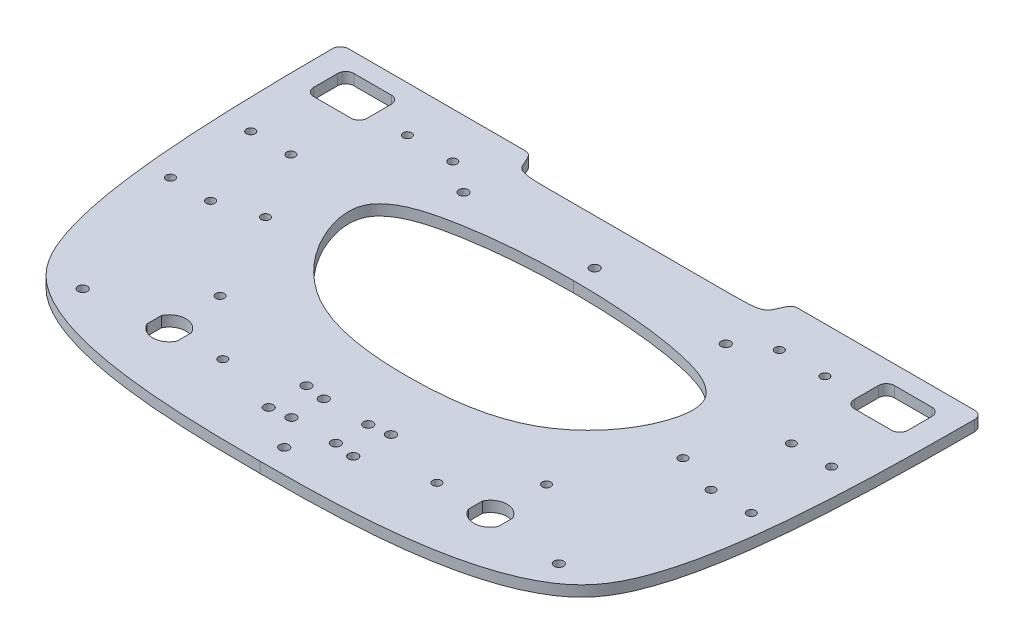
from build123d import *

# Parameters (mm, degrees)
SKETCH1_W           = 240
SKETCH1_H           = 310
BOSS_EXTRUDE1_DEPTH = 4
CUT_EXTRUDE1_REACH  = 198.064
SKETCH2_R           = 1.75
SKETCH3_R           = 1.75
CUT_EXTRUDE2_DEPTH  = 197.06376528
SKETCH4_R           = 1.75
CUT_EXTRUDE3_DEPTH  = 197.06184897
SKETCH5_R           = 1.6
CUT_EXTRUDE4_DEPTH  = 197.06184897
CUT_EXTRUDE5_DEPTH  = 197.06184897
SKETCH8_R           = 1.75
CUT_EXTRUDE7_DEPTH  = 197.06184897
FILLET1_R           = 3
CUT_EXTRUDE9_DEPTH  = 197.058343884
SKETCH14_R          = 1.6
CUT_EXTRUDE10_DEPTH = 197.058343884
SKETCH15_R          = 1.6
CUT_EXTRUDE11_DEPTH = 197.058343884
CUT_EXTRUDE12_DEPTH = 197.058343884


with BuildPart() as part:
    # Sketch1 → Boss-Extrude1 (new body)
    with BuildSketch(Plane(origin=(0, 0, 0), x_dir=(1, 0, 0), z_dir=(0, 1, 0))):
        Rectangle(SKETCH1_W, SKETCH1_H)
    extrude(amount=BOSS_EXTRUDE1_DEPTH)

    # Sketch2 → Cut-Extrude1 (cut, up to next)
    with BuildSketch(Plane(origin=(0, 4, 0), x_dir=(1, 0, 0), z_dir=(0, 1, 0)), mode=Mode.PRIVATE) as cut_extrude1_sk1:
        with BuildLine():
            Line((-120, 155), (-120, 0))
            add(Edge.make_bspline(
                [(0, 155), (-30.572222193, 155), (-80.343316982, 153.733320995), (-119.221157946, 117.654395612), (-120, 45.41001223), (-120, 0)],
                knots=[0, 0, 0, 0, 0.458017491, 0.558017491, 1, 1, 1, 1], degree=3))
            Line((0, 155), (-120, 155))
        make_face()
    cut_extrude1_tool1 = extrude(cut_extrude1_sk1.sketch, amount=-CUT_EXTRUDE1_REACH, mode=Mode.PRIVATE) & part.part
    # Sketch2 → Cut-Extrude1 (cut, up to next)
    with BuildSketch(Plane(origin=(0, 4, 0), x_dir=(1, 0, 0), z_dir=(0, 1, 0)), mode=Mode.PRIVATE) as cut_extrude1_sk2:
        with BuildLine():
            add(Edge.make_bspline(
                [(0, 155), (30.572222193, 155), (80.343316982, 153.733320995), (119.221157946, 117.654395612), (120, 45.41001223), (120, 0)],
                knots=[0, 0, 0, 0, 0.458017491, 0.558017491, 1, 1, 1, 1], degree=3))
            Line((120, 0), (120, 155))
            Line((120, 155), (0, 155))
        make_face()
    cut_extrude1_tool2 = extrude(cut_extrude1_sk2.sketch, amount=-CUT_EXTRUDE1_REACH, mode=Mode.PRIVATE) & part.part
    # Sketch2 → Cut-Extrude1 (cut, up to next)
    with BuildSketch(Plane(origin=(0, 4, 0), x_dir=(1, 0, 0), z_dir=(0, 1, 0)), mode=Mode.PRIVATE) as cut_extrude1_sk3:
        with BuildLine():
            Line((120, -155), (120, 0))
            add(Edge.make_bspline(
                [(0, -155), (30.572222193, -155), (80.343316982, -153.733320995), (119.221157946, -117.654395612), (120, -45.41001223), (120, 0)],
                knots=[0, 0, 0, 0, 0.458017491, 0.558017491, 1, 1, 1, 1], degree=3))
            Line((0, -155), (120, -155))
        make_face()
    cut_extrude1_tool3 = extrude(cut_extrude1_sk3.sketch, amount=-CUT_EXTRUDE1_REACH, mode=Mode.PRIVATE) & part.part
    # Sketch2 → Cut-Extrude1 (cut, up to next)
    with BuildSketch(Plane(origin=(0, 4, 0), x_dir=(1, 0, 0), z_dir=(0, 1, 0)), mode=Mode.PRIVATE) as cut_extrude1_sk4:
        with BuildLine():
            add(Edge.make_bspline(
                [(0, -155), (-30.572222193, -155), (-80.343316982, -153.733320995), (-119.221157946, -117.654395612), (-120, -45.41001223), (-120, 0)],
                knots=[0, 0, 0, 0, 0.458017491, 0.558017491, 1, 1, 1, 1], degree=3))
            Line((-120, 0), (-120, -155))
            Line((-120, -155), (0, -155))
        make_face()
    cut_extrude1_tool4 = extrude(cut_extrude1_sk4.sketch, amount=-CUT_EXTRUDE1_REACH, mode=Mode.PRIVATE) & part.part
    # Sketch2 → Cut-Extrude1 (cut, up to next)
    with BuildSketch(Plane(origin=(0, 4, 0), x_dir=(1, 0, 0), z_dir=(0, 1, 0)), mode=Mode.PRIVATE) as cut_extrude1_sk5:
        with Locations(Location((-88.957037006, 132.338171163, 0), (0, 0, 270))):
            Circle(SKETCH2_R)
    cut_extrude1_tool5 = extrude(cut_extrude1_sk5.sketch, amount=-CUT_EXTRUDE1_REACH, mode=Mode.PRIVATE) & part.part
    # Sketch2 → Cut-Extrude1 (cut, up to next)
    with BuildSketch(Plane(origin=(0, 4, 0), x_dir=(1, 0, 0), z_dir=(0, 1, 0)), mode=Mode.PRIVATE) as cut_extrude1_sk6:
        with Locations(Location((0, 146, 0), (0, 0, 270))):
            Circle(SKETCH2_R)
    cut_extrude1_tool6 = extrude(cut_extrude1_sk6.sketch, amount=-CUT_EXTRUDE1_REACH, mode=Mode.PRIVATE) & part.part
    # Sketch2 → Cut-Extrude1 (cut, up to next)
    with BuildSketch(Plane(origin=(0, 4, 0), x_dir=(1, 0, 0), z_dir=(0, 1, 0)), mode=Mode.PRIVATE) as cut_extrude1_sk7:
        with Locations(Location((88.957037006, 132.338171163, 0), (0, 0, 270))):
            Circle(SKETCH2_R)
    cut_extrude1_tool7 = extrude(cut_extrude1_sk7.sketch, amount=-CUT_EXTRUDE1_REACH, mode=Mode.PRIVATE) & part.part
    # Sketch2 → Cut-Extrude1 (cut, up to next)
    with BuildSketch(Plane(origin=(0, 4, 0), x_dir=(1, 0, 0), z_dir=(0, 1, 0)), mode=Mode.PRIVATE) as cut_extrude1_sk8:
        with Locations(Location((-110.418476952, 44.934472183, 0), (0, 0, 270))):
            Circle(SKETCH2_R)
    cut_extrude1_tool8 = extrude(cut_extrude1_sk8.sketch, amount=-CUT_EXTRUDE1_REACH, mode=Mode.PRIVATE) & part.part
    # Sketch2 → Cut-Extrude1 (cut, up to next)
    with BuildSketch(Plane(origin=(0, 4, 0), x_dir=(1, 0, 0), z_dir=(0, 1, 0)), mode=Mode.PRIVATE) as cut_extrude1_sk9:
        with Locations(Location((-49, -30, 0), (0, 0, 270))):
            Circle(SKETCH2_R)
    cut_extrude1_tool9 = extrude(cut_extrude1_sk9.sketch, amount=-CUT_EXTRUDE1_REACH, mode=Mode.PRIVATE) & part.part
    # Sketch2 → Cut-Extrude1 (cut, up to next)
    with BuildSketch(Plane(origin=(0, 4, 0), x_dir=(1, 0, 0), z_dir=(0, 1, 0)), mode=Mode.PRIVATE) as cut_extrude1_sk10:
        with Locations(Location((49, -30, 0), (0, 0, 270))):
            Circle(SKETCH2_R)
    cut_extrude1_tool10 = extrude(cut_extrude1_sk10.sketch, amount=-CUT_EXTRUDE1_REACH, mode=Mode.PRIVATE) & part.part
    # Sketch2 → Cut-Extrude1 (cut, up to next)
    with BuildSketch(Plane(origin=(0, 4, 0), x_dir=(1, 0, 0), z_dir=(0, 1, 0)), mode=Mode.PRIVATE) as cut_extrude1_sk11:
        with Locations(Location((-88.957037006, -132.338171163, 0), (0, 0, 270))):
            Circle(SKETCH2_R)
    cut_extrude1_tool11 = extrude(cut_extrude1_sk11.sketch, amount=-CUT_EXTRUDE1_REACH, mode=Mode.PRIVATE) & part.part
    # Sketch2 → Cut-Extrude1 (cut, up to next)
    with BuildSketch(Plane(origin=(0, 4, 0), x_dir=(1, 0, 0), z_dir=(0, 1, 0)), mode=Mode.PRIVATE) as cut_extrude1_sk12:
        with Locations(Location((0, -146, 0), (0, 0, 270))):
            Circle(SKETCH2_R)
    cut_extrude1_tool12 = extrude(cut_extrude1_sk12.sketch, amount=-CUT_EXTRUDE1_REACH, mode=Mode.PRIVATE) & part.part
    # Sketch2 → Cut-Extrude1 (cut, up to next)
    with BuildSketch(Plane(origin=(0, 4, 0), x_dir=(1, 0, 0), z_dir=(0, 1, 0)), mode=Mode.PRIVATE) as cut_extrude1_sk13:
        with Locations(Location((88.957037006, -132.338171163, 0), (0, 0, 270))):
            Circle(SKETCH2_R)
    cut_extrude1_tool13 = extrude(cut_extrude1_sk13.sketch, amount=-CUT_EXTRUDE1_REACH, mode=Mode.PRIVATE) & part.part
    # Sketch2 → Cut-Extrude1 (cut, up to next)
    with BuildSketch(Plane(origin=(0, 4, 0), x_dir=(1, 0, 0), z_dir=(0, 1, 0)), mode=Mode.PRIVATE) as cut_extrude1_sk14:
        with Locations(Location((110.418476952, 44.934472183, 0), (0, 0, 270))):
            Circle(SKETCH2_R)
    cut_extrude1_tool14 = extrude(cut_extrude1_sk14.sketch, amount=-CUT_EXTRUDE1_REACH, mode=Mode.PRIVATE) & part.part
    add(cut_extrude1_tool1.solids().sort_by_distance((-102.173006, 4, -133.115769))[0], mode=Mode.SUBTRACT)
    add(cut_extrude1_tool2.solids().sort_by_distance((102.087926, 4, -133.133004))[0], mode=Mode.SUBTRACT)
    add(cut_extrude1_tool3.solids().sort_by_distance((102.087926, 4, 133.133004))[0], mode=Mode.SUBTRACT)
    add(cut_extrude1_tool4.solids().sort_by_distance((-102.173006, 4, 133.115769))[0], mode=Mode.SUBTRACT)
    add(cut_extrude1_tool5.solids().sort_by_distance((-88.957037, 4, -132.338171))[0], mode=Mode.SUBTRACT)
    add(cut_extrude1_tool6.solids().sort_by_distance((0, 4, -146))[0], mode=Mode.SUBTRACT)
    add(cut_extrude1_tool7.solids().sort_by_distance((88.957037, 4, -132.338171))[0], mode=Mode.SUBTRACT)
    add(cut_extrude1_tool8.solids().sort_by_distance((-110.418477, 4, -44.934472))[0], mode=Mode.SUBTRACT)
    add(cut_extrude1_tool9.solids().sort_by_distance((-49, 4, 30))[0], mode=Mode.SUBTRACT)
    add(cut_extrude1_tool10.solids().sort_by_distance((49, 4, 30))[0], mode=Mode.SUBTRACT)
    add(cut_extrude1_tool11.solids().sort_by_distance((-88.957037, 4, 132.338171))[0], mode=Mode.SUBTRACT)
    add(cut_extrude1_tool12.solids().sort_by_distance((0, 4, 146))[0], mode=Mode.SUBTRACT)
    add(cut_extrude1_tool13.solids().sort_by_distance((88.957037, 4, 132.338171))[0], mode=Mode.SUBTRACT)
    add(cut_extrude1_tool14.solids().sort_by_distance((110.418477, 4, -44.934472))[0], mode=Mode.SUBTRACT)

    # Sketch3 → Cut-Extrude2 (cut, through all)
    # profile 1 of 2: a face of its own
    with BuildSketch(Plane(origin=(0, 4, 0), x_dir=(1, 0, 0), z_dir=(0, 1, 0))):
        with BuildLine():
            Line((120, 0), (-120, 0))
            add(Edge.make_bspline(
                [(-120, 0), (-120, -1.649620662), (-119.999161826, -3.317063079), (-119.996868981, -5)],
                knots=[0, 0, 0, 0, 0.016056007, 0.016056007, 0.016056007, 0.016056007], degree=3))
            Line((-119.996868981, -5), (119.996868981, -5))
            add(Edge.make_bspline(
                [(119.996868981, -5), (119.999161826, -3.317063079), (120, -1.649620662), (120, 0)],
                knots=[0.983943993, 0.983943993, 0.983943993, 0.983943993, 1, 1, 1, 1], degree=3))
        make_face()
    # profile 2 of 2: a face of its own
    with BuildSketch(Plane(origin=(0, 4, 0), x_dir=(1, 0, 0), z_dir=(0, 1, 0))):
        with BuildLine():
            Line((-120, 0), (120, 0))
            add(Edge.make_bspline(
                [(120, 0), (120, 45.41001223), (119.221157946, 117.654395612), (80.343316982, 153.733320995), (30.572222193, 155), (0, 155)],
                knots=[0, 0, 0, 0, 0.441982509, 0.541982509, 1, 1, 1, 1], degree=3))
            add(Edge.make_bspline(
                [(0, 155), (-30.572222193, 155), (-80.343316982, 153.733320995), (-119.221157946, 117.654395612), (-120, 45.41001223), (-120, 0)],
                knots=[0, 0, 0, 0, 0.458017491, 0.558017491, 1, 1, 1, 1], degree=3))
        make_face()
        with Locations((110.418476952, 44.934472183)):
            Circle(SKETCH3_R, mode=Mode.SUBTRACT)
        with Locations((0, 146)):
            Circle(SKETCH3_R, mode=Mode.SUBTRACT)
        with Locations((-88.957037006, 132.338171163)):
            Circle(SKETCH3_R, mode=Mode.SUBTRACT)
        with Locations((-110.418476952, 44.934472183)):
            Circle(SKETCH3_R, mode=Mode.SUBTRACT)
        with Locations((88.957037006, 132.338171163)):
            Circle(SKETCH3_R, mode=Mode.SUBTRACT)
    extrude(amount=-CUT_EXTRUDE2_DEPTH, mode=Mode.SUBTRACT)

    # Sketch4 → Cut-Extrude3 (cut, through all)
    with BuildSketch(Plane(origin=(0, 4, 0), x_dir=(1, 0, 0), z_dir=(0, 1, 0))):
        with Locations(Location((0, -30, 0), (0, 0, 270))):
            Circle(SKETCH4_R)
    extrude(amount=-CUT_EXTRUDE3_DEPTH, mode=Mode.SUBTRACT)

    # Sketch5 → Cut-Extrude4 (cut, through all)
    with BuildSketch(Plane(origin=(0, 4, 0), x_dir=(1, 0, 0), z_dir=(0, 1, 0))):
        with Locations(Location((-61, -108.999999999, 0), (0, 0, 270))):
            Circle(SKETCH5_R)
        with Locations(Location((-61, -21.999999999, 0), (0, 0, 270))):
            Circle(SKETCH5_R)
        with Locations(Location((61, -22, 0), (0, 0, 270))):
            Circle(SKETCH5_R)
        with Locations(Location((61, -109, 0), (0, 0, 270))):
            Circle(SKETCH5_R)
        with BuildLine():
            Line((-51, -4.999999999), (51, -4.999999999))
            add(Edge.make_bspline(
                [(51, -4.999999999), (49.129635358, -4.999999999), (47.569011078, -8.0005268), (47.376387634, -8.775390708), (45.540706521, -12.653742164), (41.68256642, -12.999999999), (34.542577711, -12.999999999)],
                knots=[0, 0, 0, 0, 0.228374011, 0.487299701, 0.5644623, 1, 1, 1, 1], degree=3))
            Line((34.542577711, -12.999999999), (-34.542577711, -12.999999999))
            add(Edge.make_bspline(
                [(-51, -4.999999999), (-49.129635358, -4.999999999), (-47.569011078, -8.0005268), (-47.376387634, -8.775390708), (-45.540706521, -12.653742164), (-41.68256642, -12.999999999), (-34.542577711, -12.999999999)],
                knots=[0, 0, 0, 0, 0.228374011, 0.487299701, 0.5644623, 1, 1, 1, 1], degree=3))
        make_face()
    extrude(amount=-CUT_EXTRUDE4_DEPTH, mode=Mode.SUBTRACT)

    # Sketch6 → Cut-Extrude5 (cut, through all)
    with BuildSketch(Plane(origin=(0, 4, 0), x_dir=(1, 0, 0), z_dir=(0, 1, 0))):
        with BuildLine():
            add(Edge.make_bspline(
                [(0, -37.999999999), (-12.450752094, -37.999999999), (-30.689118986, -38.969591878), (-50.22157285, -43.370024939), (-57.865658077, -46.305561809), (-66.31863453, -54.257905938), (-62.773209765, -68.026537664), (-54.373147371, -81.480565894), (-35.75248125, -98.07851213), (-12.638341611, -99.999999999), (0, -99.999999999)],
                knots=[0, 0, 0, 0, 0.264131069, 0.321740627, 0.388216858, 0.419341791, 0.536423737, 0.607786801, 0.734444613, 1, 1, 1, 1], degree=3))
            add(Edge.make_bspline(
                [(0, -37.999999999), (12.450752094, -37.999999999), (30.689118986, -38.969591878), (50.22157285, -43.370024939), (57.865658077, -46.305561809), (66.31863453, -54.257905938), (62.773209765, -68.026537664), (54.373147371, -81.480565894), (35.75248125, -98.07851213), (12.638341611, -99.999999999), (0, -99.999999999)],
                knots=[0, 0, 0, 0, 0.264131069, 0.321740627, 0.388216858, 0.419341791, 0.536423737, 0.607786801, 0.734444613, 1, 1, 1, 1], degree=3))
        make_face()
    extrude(amount=-CUT_EXTRUDE5_DEPTH, mode=Mode.SUBTRACT)

    # Sketch8 → Cut-Extrude7 (cut, through all)
    with BuildSketch(Plane(origin=(0, 4, 0), x_dir=(1, 0, 0), z_dir=(0, 1, 0))):
        with Locations(Location((-8.3, -122.9, 0), (0, 0, 270))):
            Circle(SKETCH8_R)
        with Locations(Location((8.3, -122.9, 0), (0, 0, 90))):
            Circle(SKETCH8_R)
        with Locations(Location((8.3, -135, 0), (0, 0, 270))):
            Circle(SKETCH8_R)
        with Locations(Location((-8.3, -135, 0), (0, 0, 90))):
            Circle(SKETCH8_R)
        with Locations(Location((-15.8, -121.9, 0), (0, 0, 270))):
            Circle(SKETCH8_R)
        with Locations(Location((-15.8, -136, 0), (0, 0, 270))):
            Circle(SKETCH8_R)
        with Locations(Location((15.8, -136, 0), (0, 0, 270))):
            Circle(SKETCH8_R)
        with Locations(Location((15.8, -121.9, 0), (0, 0, 270))):
            Circle(SKETCH8_R)
    extrude(amount=-CUT_EXTRUDE7_DEPTH, mode=Mode.SUBTRACT)

    # Fillet1
    fillet1_edges = [part.edges().sort_by_distance(p)[0] for p in [
        (-119.996868981, 2, 5),
        (119.996868981, 2, 5),
    ]]
    fillet(fillet1_edges, radius=FILLET1_R)

    # Sketch13 → Cut-Extrude9 (cut, through all)
    with BuildSketch(Plane(origin=(0, 4, 0), x_dir=(1, 0, 0), z_dir=(0, 1, 0))):
        with BuildLine():
            Line((94, -12), (108, -12))
            ThreePointArc((108, -12), (110.121320344, -12.878679656), (111, -15))
            Line((111, -15), (111, -24))
            ThreePointArc((111, -24), (110.121320344, -26.121320344), (108, -27))
            Line((108, -27), (94, -27))
            ThreePointArc((94, -27), (91.878679656, -26.121320344), (91, -24))
            Line((91, -24), (91, -15))
            ThreePointArc((91, -15), (91.878679656, -12.878679656), (94, -12))
        make_face()
        with BuildLine():
            Line((-94, -27), (-108, -27))
            ThreePointArc((-108, -27), (-110.121320344, -26.121320344), (-111, -24))
            Line((-111, -24), (-111, -15))
            ThreePointArc((-111, -15), (-110.121320344, -12.878679656), (-108, -12))
            Line((-108, -12), (-94, -12))
            ThreePointArc((-94, -12), (-91.878679656, -12.878679656), (-91, -15))
            Line((-91, -15), (-91, -24))
            ThreePointArc((-91, -24), (-91.878679656, -26.121320344), (-94, -27))
        make_face()
    extrude(amount=-CUT_EXTRUDE9_DEPTH, mode=Mode.SUBTRACT)

    # Sketch14 → Cut-Extrude10 (cut, through all)
    with BuildSketch(Plane(origin=(0, 4, 0), x_dir=(1, 0, 0), z_dir=(0, 1, 0))):
        with Locations(Location((78, -75, 0), (0, 0, 270))):
            Circle(SKETCH14_R)
        with Locations(Location((78, -22, 0), (0, 0, 270))):
            Circle(SKETCH14_R)
        with Locations(Location((40, -128.95, 0), (0, 0, 270))):
            Circle(SKETCH14_R)
        with Locations(Location((-40, -128.95, 0), (0, 0, 90))):
            Circle(SKETCH14_R)
        with Locations(Location((-78, -75, 0), (0, 0, 90))):
            Circle(SKETCH14_R)
        with Locations(Location((-78, -22, 0), (0, 0, 90))):
            Circle(SKETCH14_R)
    extrude(amount=-CUT_EXTRUDE10_DEPTH, mode=Mode.SUBTRACT)

    # Sketch15 → Cut-Extrude11 (cut, through all)
    with BuildSketch(Plane(origin=(0, 4, 0), x_dir=(1, 0, 0), z_dir=(0, 1, 0))):
        with Locations(Location((93.5, -50, 0), (0, 0, 270))):
            Circle(SKETCH15_R)
        with Locations(Location((93.5, -80, 0), (0, 0, 270))):
            Circle(SKETCH15_R)
        with Locations(Location((108.5, -50, 0), (0, 0, 270))):
            Circle(SKETCH15_R)
        with Locations(Location((108.5, -80, 0), (0, 0, 270))):
            Circle(SKETCH15_R)
        with Locations(Location((-108.5, -50, 0), (0, 0, 90))):
            Circle(SKETCH15_R)
        with Locations(Location((-108.5, -80, 0), (0, 0, 90))):
            Circle(SKETCH15_R)
        with Locations(Location((-93.5, -80, 0), (0, 0, 90))):
            Circle(SKETCH15_R)
        with Locations(Location((-93.5, -50, 0), (0, 0, 90))):
            Circle(SKETCH15_R)
    extrude(amount=-CUT_EXTRUDE11_DEPTH, mode=Mode.SUBTRACT)

    # Sketch16 → Cut-Extrude12 (cut, through all)
    with BuildSketch(Plane(origin=(0, 4, 0), x_dir=(1, 0, 0), z_dir=(0, 1, 0))):
        with BuildLine():
            Line((54.4, -126.289173061), (54.4, -131.610826939))
            ThreePointArc((54.4, -131.610826939), (60, -135.15), (65.6, -131.610826939))
            Line((65.6, -131.610826939), (65.6, -126.289173061))
            ThreePointArc((65.6, -126.289173061), (60, -122.75), (54.4, -126.289173061))
        make_face()
        with BuildLine():
            Line((-65.6, -126.289173061), (-65.6, -131.610826939))
            ThreePointArc((-65.6, -131.610826939), (-60, -135.15), (-54.4, -131.610826939))
            Line((-54.4, -131.610826939), (-54.4, -126.289173061))
            ThreePointArc((-54.4, -126.289173061), (-60, -122.75), (-65.6, -126.289173061))
        make_face()
    extrude(amount=-CUT_EXTRUDE12_DEPTH, mode=Mode.SUBTRACT)


solid = part.part
